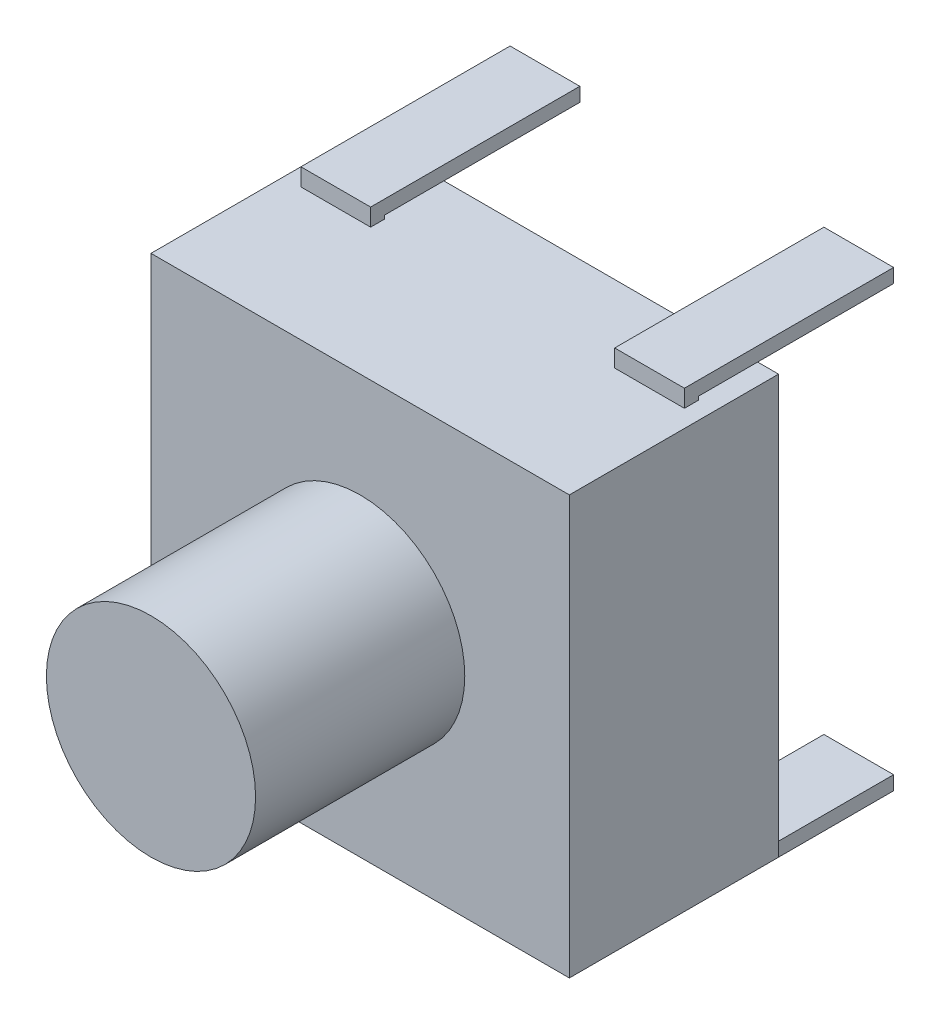
from build123d import *

# Parameters (mm, degrees)
SKETCH_1_W               = 6
SKETCH_1_H               = 6
EXTRUDE_1_DEPTH          = 3
SKETCH_2_R               = 1.5
EXTRUDE_2_DEPTH          = 3
SKETCH_4_W               = 1
SKETCH_4_H               = 0.2
MIRROR_2_COPY_1_SKETCH_W = 1
MIRROR_2_COPY_1_SKETCH_H = 0.2


with BuildPart() as part:
    # 草图1 → 凸台-拉伸1 (new body)
    with BuildSketch(Plane.XY):
        Rectangle(SKETCH_1_W, SKETCH_1_H)
    extrude(amount=EXTRUDE_1_DEPTH)

    # 草图2 → 凸台-拉伸2 (add)
    with BuildSketch(Plane.XY.offset(3)):
        with Locations(Location((0, 0, 0), (0, 0, 180))):
            Circle(SKETCH_2_R)
    extrude(amount=EXTRUDE_2_DEPTH)

    # 扫描3: sweep along a path in 草图6
    with BuildLine(Plane(origin=(2.25, 0, 0), x_dir=(0, 0, -1), z_dir=(1, 0, 0))) as sweep_3_path:
        Line((-1.1, -3), (-1.1, -3.25))
        Line((-1.1, -3.25), (1.9, -3.25))
    # 草图4 → 扫描3 (sweep)
    with BuildSketch(Plane.XZ.offset(3)):
        with Locations((2.25, 1)):
            Rectangle(SKETCH_4_W, SKETCH_4_H)
    sweep_3 = sweep(path=sweep_3_path.line, transition=Transition.RIGHT)

    # 镜向1: 扫描3 across plane
    add(sweep_3.mirror(Plane(origin=(0, 0, 0), x_dir=(0, 0, 1), z_dir=(1, 0, 0))))

    # 镜向2: 扫描3 across plane
    add(sweep_3.mirror(Plane.ZX))

    # 镜向2 copy 1: sweep along a path in 镜向2 copy 1 path
    with BuildLine(Plane(origin=(-2.25, 0, 0), x_dir=(0, 0, -1), z_dir=(-1, 0, 0))) as mirror_2_copy_1_path:
        Line((-1.1, -3), (-1.1, -3.25))
        Line((-1.1, -3.25), (1.9, -3.25))
    # 镜向2 copy 1 sketch → 镜向2 copy 1 (sweep)
    with BuildSketch(Plane(origin=(0, 3, 0), x_dir=(-1, 0, 0), z_dir=(0, 1, 0))):
        with Locations((2.25, 1)):
            Rectangle(MIRROR_2_COPY_1_SKETCH_W, MIRROR_2_COPY_1_SKETCH_H)
    sweep(path=mirror_2_copy_1_path.line, transition=Transition.RIGHT)


solid = part.part
